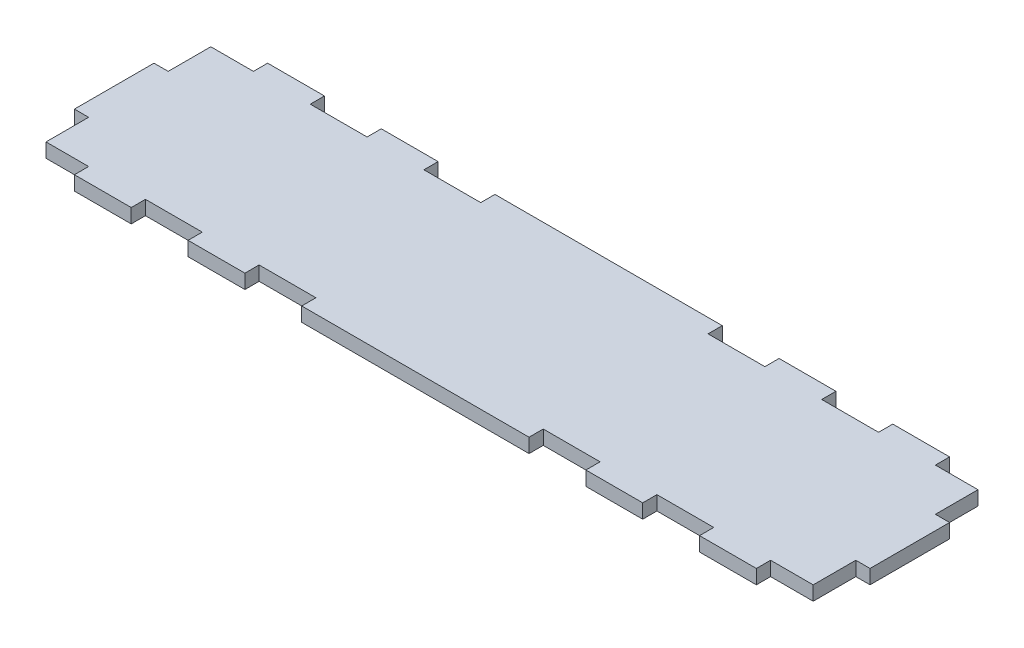
from build123d import *

# Parameters (mm, degrees)
SKETCH1_W           = 171.45
SKETCH1_H           = 36.83
BOSS_EXTRUDE1_DEPTH = 3.175
SKETCH2_W           = 12.7
SKETCH2_H           = 3.175
SKETCH2_W_2         = 50.8
BOSS_EXTRUDE2_DEPTH = 3.175
SKETCH3_W           = 42.418
SKETCH3_H           = 12.7
CUT_EXTRUDE1_DEPTH  = 3.175
SKETCH5_W           = 17.018
SKETCH5_H           = 12.7
BOSS_EXTRUDE3_DEPTH = 3.175
SKETCH6_W           = 3.175
SKETCH6_H           = 17.78
BOSS_EXTRUDE4_DEPTH = 3.175
SKETCH7_W           = 59.348335251
SKETCH7_H           = 25.17302984
BOSS_EXTRUDE5_DEPTH = 3.175


with BuildPart() as part:
    # Sketch1 → Boss-Extrude1 (new body)
    with BuildSketch(Plane(origin=(0, 0, 0), x_dir=(1, 0, 0), z_dir=(0, 1, 0))):
        with Locations((85.725, 18.415)):
            Rectangle(SKETCH1_W, SKETCH1_H)
    extrude(amount=BOSS_EXTRUDE1_DEPTH)

    # Sketch2 → Boss-Extrude2 (add)
    with BuildSketch(Plane(origin=(0, 3.175, 0), x_dir=(1, 0, 0), z_dir=(0, 1, 0))):
        with Locations((15.875, -1.5875)):
            Rectangle(SKETCH2_W, SKETCH2_H)
        with Locations((41.275, -1.5875)):
            Rectangle(SKETCH2_W, SKETCH2_H)
        with Locations((85.725, -1.5875)):
            Rectangle(SKETCH2_W_2, SKETCH2_H)
        with Locations((130.175, -1.5875)):
            Rectangle(SKETCH2_W, SKETCH2_H)
        with Locations((155.575, -1.5875)):
            Rectangle(SKETCH2_W, SKETCH2_H)
    boss_extrude2 = extrude(amount=-BOSS_EXTRUDE2_DEPTH)

    # Sketch3 → Cut-Extrude1 (cut)
    with BuildSketch(Plane(origin=(0, 3.175, 0), x_dir=(1, 0, 0), z_dir=(0, 1, 0))):
        with Locations((88.646, 9.525)):
            Rectangle(SKETCH3_W, SKETCH3_H)
    extrude(amount=-CUT_EXTRUDE1_DEPTH, mode=Mode.SUBTRACT)

    # Sketch5 → Boss-Extrude3 (add)
    with BuildSketch(Plane(origin=(0, 3.175, 0), x_dir=(1, 0, 0), z_dir=(0, 1, 0))):
        with Locations((89.916, 9.525)):
            Rectangle(SKETCH5_W, SKETCH5_H)
    extrude(amount=-BOSS_EXTRUDE3_DEPTH)

    # Sketch6 → Boss-Extrude4 (add)
    with BuildSketch(Plane(origin=(0, 3.175, 0), x_dir=(1, 0, 0), z_dir=(0, 1, 0))):
        with Locations((-1.5875, 18.415)):
            Rectangle(SKETCH6_W, SKETCH6_H)
        with Locations((173.0375, 18.415)):
            Rectangle(SKETCH6_W, SKETCH6_H)
    extrude(amount=-BOSS_EXTRUDE4_DEPTH)

    # Mirror1: Boss-Extrude2 across plane
    add(boss_extrude2.mirror(Plane(origin=(0, 0, -18.415), x_dir=(1, 0, 0), z_dir=(0, 0, -1))))

    # Sketch7 → Boss-Extrude5 (add)
    with BuildSketch(Plane(origin=(0, 3.175, 0), x_dir=(1, 0, 0), z_dir=(0, 1, 0))):
        with Locations((85.808354404, 13.913862214)):
            Rectangle(SKETCH7_W, SKETCH7_H)
    extrude(amount=-BOSS_EXTRUDE5_DEPTH)


solid = part.part
